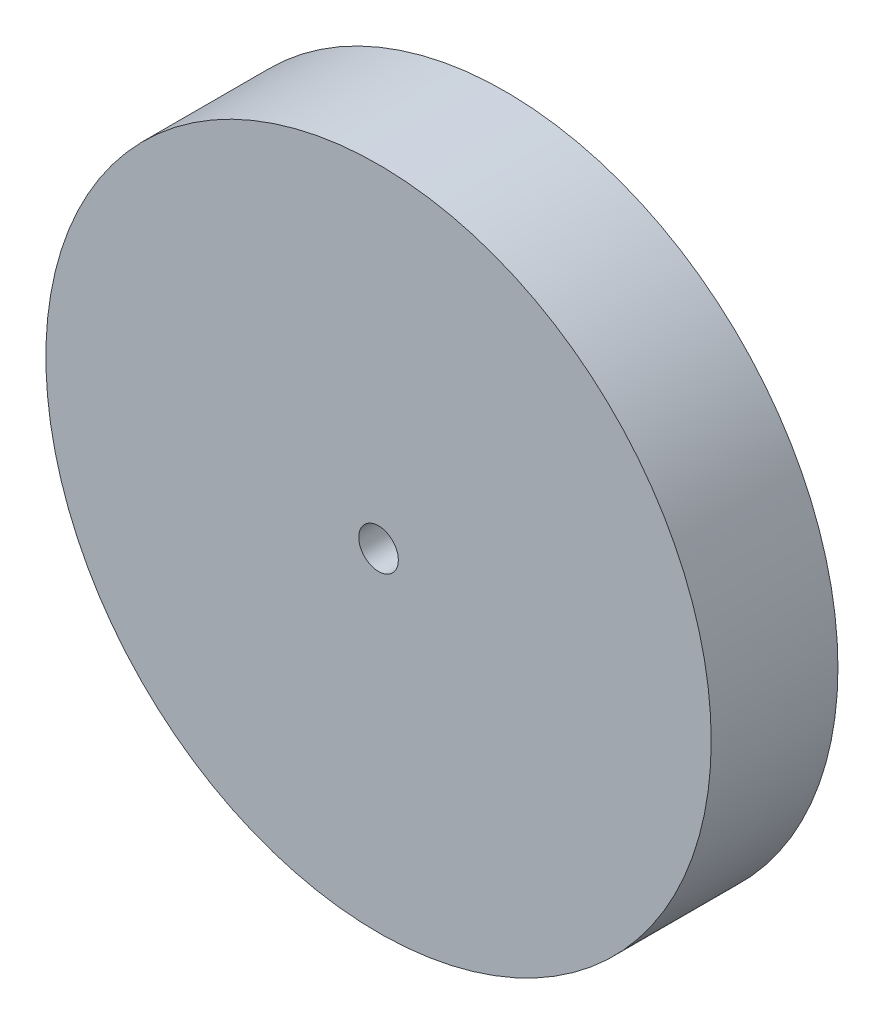
from build123d import *

# Parameters (mm, degrees)
SKETCH1_R           = 21
BOSS_EXTRUDE1_DEPTH = 8
SKETCH2_R           = 1.25
CUT_EXTRUDE1_DEPTH  = 8


with BuildPart() as part:
    # Sketch1 → Boss-Extrude1 (new body)
    with BuildSketch(Plane.XY):
        Circle(SKETCH1_R)
    extrude(amount=BOSS_EXTRUDE1_DEPTH)

    # Sketch2 → Cut-Extrude1 (cut)
    with BuildSketch(Plane.XY.offset(8)):
        Circle(SKETCH2_R)
    extrude(amount=-CUT_EXTRUDE1_DEPTH, mode=Mode.SUBTRACT)


solid = part.part
